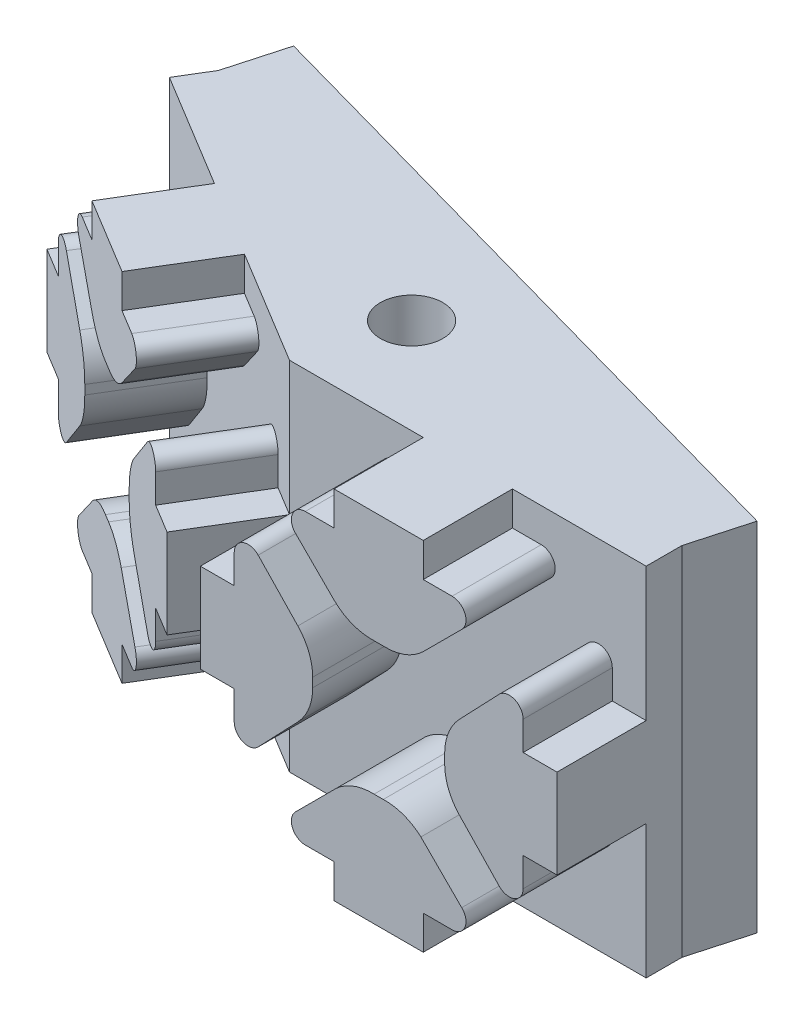
from build123d import *

# Parameters (mm, degrees)
SKIZZE1_W                       = 20
SKIZZE1_H                       = 20
AUFSATZ_LINEAR_AUSTRAGEN1_DEPTH = 2
AUFSATZ_LINEAR_AUSTRAGEN3_DEPTH = 5
VERRUNDUNG1_R                   = 3
VERRUNDUNG1_OF_SPIEGELN1_R      = 3
AUFSATZ_LINEAR_AUSTRAGEN4_REACH = 35.564
SKIZZE3_W                       = 37.447689889
SKIZZE3_H                       = 20
SCHNITT_LINEAR_AUSTRAGEN1_DEPTH = 32.884097459
SKIZZE4_3_R                     = 2.9
SKIZZE4_3_R_2                   = 1.75
SCHNITT_LINEAR_AUSTRAGEN2_DEPTH = 16


with BuildPart() as part:
    # Skizze1 → Aufsatz-Linear austragen1 (new body)
    with BuildSketch(Plane.XY):
        with Locations((10, 10)):
            Rectangle(SKIZZE1_W, SKIZZE1_H)
    aufsatz_linear_austragen1 = extrude(amount=AUFSATZ_LINEAR_AUSTRAGEN1_DEPTH)

    # Skizze2 → Aufsatz-Linear austragen3 (add)
    with BuildSketch(Plane.XY.offset(2)):
        with BuildLine():
            Line((12.5, 18.1), (12.5, 20))
            Line((12.5, 20), (7.5, 20))
            Line((7.5, 20), (7.5, 18.1))
            Line((7.5, 18.1), (5.883086579, 18.1))
            ThreePointArc((5.883086579, 18.1), (5.159199271, 17.610494692), (5.343893194, 16.756377348))
            Line((5.343893194, 16.756377348), (8.350270542, 13.75))
            Line((8.350270542, 13.75), (11.649729458, 13.75))
            Line((11.649729458, 13.75), (14.656106806, 16.756377348))
            ThreePointArc((14.656106806, 16.756377348), (14.840800729, 17.610494692), (14.116913421, 18.1))
            Line((14.116913421, 18.1), (12.5, 18.1))
        make_face()
        with BuildLine():
            Line((1.9, 12.5), (0, 12.5))
            Line((0, 12.5), (0, 7.5))
            Line((0, 7.5), (1.9, 7.5))
            Line((1.9, 7.5), (1.9, 5.883086579))
            ThreePointArc((1.9, 5.883086579), (2.389505308, 5.159199271), (3.243622652, 5.343893194))
            Line((3.243622652, 5.343893194), (5.46777943, 7.668819976))
            ThreePointArc((5.46777943, 7.668819976), (6.084181953, 8.625353412), (6.3, 9.742640687))
            Line((6.3, 9.742640687), (6.3, 10.257359313))
            ThreePointArc((6.3, 10.257359313), (6.084181953, 11.374646588), (5.46777943, 12.331180024))
            Line((5.46777943, 12.331180024), (3.243622652, 14.656106806))
            ThreePointArc((3.243622652, 14.656106806), (2.389505308, 14.840800729), (1.9, 14.116913421))
            Line((1.9, 14.116913421), (1.9, 12.5))
        make_face()
        with BuildLine():
            Line((7.5, 0), (12.5, 0))
            Line((12.5, 0), (12.5, 1.9))
            Line((12.5, 1.9), (14.116913421, 1.9))
            ThreePointArc((14.116913421, 1.9), (14.840800729, 2.389505308), (14.656106806, 3.243622652))
            Line((14.656106806, 3.243622652), (12.366329752, 5.533399706))
            ThreePointArc((12.366329752, 5.533399706), (11.386219612, 6.121310843), (10.257359313, 6.3))
            Line((10.257359313, 6.3), (9.742640687, 6.3))
            ThreePointArc((9.742640687, 6.3), (8.613780388, 6.121310843), (7.633670248, 5.533399706))
            Line((7.633670248, 5.533399706), (5.343893194, 3.243622652))
            ThreePointArc((5.343893194, 3.243622652), (5.159199271, 2.389505308), (5.883086579, 1.9))
            Line((5.883086579, 1.9), (7.5, 1.9))
            Line((7.5, 1.9), (7.5, 0))
        make_face()
        with BuildLine():
            Line((20, 7.5), (20, 12.5))
            Line((20, 12.5), (18.1, 12.5))
            Line((18.1, 12.5), (18.1, 14.116913421))
            ThreePointArc((18.1, 14.116913421), (17.610494692, 14.840800729), (16.756377348, 14.656106806))
            Line((16.756377348, 14.656106806), (14.53222057, 12.331180024))
            ThreePointArc((14.53222057, 12.331180024), (13.915818047, 11.374646588), (13.7, 10.257359313))
            Line((13.7, 10.257359313), (13.7, 9.742640687))
            ThreePointArc((13.7, 9.742640687), (13.915818047, 8.625353412), (14.53222057, 7.668819976))
            Line((14.53222057, 7.668819976), (16.756377348, 5.343893194))
            ThreePointArc((16.756377348, 5.343893194), (17.610494692, 5.159199271), (18.1, 5.883086579))
            Line((18.1, 5.883086579), (18.1, 7.5))
            Line((18.1, 7.5), (20, 7.5))
        make_face()
    aufsatz_linear_austragen3 = extrude(amount=AUFSATZ_LINEAR_AUSTRAGEN3_DEPTH)

    # Verrundung1
    verrundung1_edges = [part.edges().sort_by_distance(p)[0] for p in [
        (8.350270542, 13.75, 4.5),
        (11.649729458, 13.75, 4.5),
    ]]
    fillet(verrundung1_edges, radius=VERRUNDUNG1_R)

    # Spiegeln1: Aufsatz-Linear austragen1, Aufsatz-Linear austragen3 across plane
    add(aufsatz_linear_austragen1.mirror(Plane(origin=(0.518393786, 0, 0.144857975), x_dir=(-0.2691263412444344, 0, 0.963104881333484), z_dir=(-0.9631048813334839, 0, -0.2691263412444344))))
    add(aufsatz_linear_austragen3.mirror(Plane(origin=(0.518393786, 0, 0.144857975), x_dir=(-0.2691263412444344, 0, 0.963104881333484), z_dir=(-0.9631048813334839, 0, -0.2691263412444344))))

    # Verrundung1 of Spiegeln1
    verrundung1_of_spiegeln1_edges = [part.edges().sort_by_distance(p)[0] for p in [
        (-8.436651724, 13.75, -0.190873297),
        (-11.258157703, 13.75, -1.901292296),
    ]]
    fillet(verrundung1_of_spiegeln1_edges, radius=VERRUNDUNG1_OF_SPIEGELN1_R)

    # Skizze3 → Aufsatz-Linear austragen4 (add, up to next)
    with BuildSketch(Plane(origin=(2.36988033, 0, -8.480936141), x_dir=(-0.963104881333484, 0, -0.26912634124443463), z_dir=(0.26912634124443463, 0, -0.963104881333484)), mode=Mode.PRIVATE) as aufsatz_linear_austragen4_sk1:
        with Locations((-0.538252683, 10)):
            Rectangle(SKIZZE3_W, SKIZZE3_H)
    aufsatz_linear_austragen4_tool1 = extrude(aufsatz_linear_austragen4_sk1.sketch, amount=-AUFSATZ_LINEAR_AUSTRAGEN4_REACH, mode=Mode.PRIVATE) - part.part
    add(aufsatz_linear_austragen4_tool1.solids().sort_by_distance((2.888274, 10, -8.336078))[0])

    # Skizze4 → Schnitt-Linear austragen1 (cut, through all)
    with BuildSketch(Plane.XZ):
        with BuildLine():
            ThreePointArc((3.245339923, -3.351275437), (2.553238921, -1.957234652), (1.024368826, -1.665841895))
            Line((1.024368826, -1.665841895), (1.966311021, -5.03670898))
            ThreePointArc((1.966311021, -5.03670898), (2.889380708, -4.409174435), (3.245339923, -3.351275437))
        make_face()
        with BuildLine():
            Line((1.966311021, -5.03670898), (1.024368826, -1.665841895))
            ThreePointArc((1.024368826, -1.665841895), (-0.190093619, -3.822246535), (1.966311021, -5.03670898))
        make_face()
    extrude(amount=-SCHNITT_LINEAR_AUSTRAGEN1_DEPTH, mode=Mode.SUBTRACT)

    # Skizze4<3> → Schnitt-Linear austragen2 (cut)
    with BuildSketch(Plane.XZ):
        with Locations(Location((1.495339923, -3.351275437, 0), (0, 0, 270))):
            Circle(SKIZZE4_3_R)
        with Locations(Location((1.495339923, -3.351275437, 0), (0, 0, 270))):
            Circle(SKIZZE4_3_R_2, mode=Mode.SUBTRACT)
    extrude(amount=-SCHNITT_LINEAR_AUSTRAGEN2_DEPTH, mode=Mode.SUBTRACT)


solid = part.part
